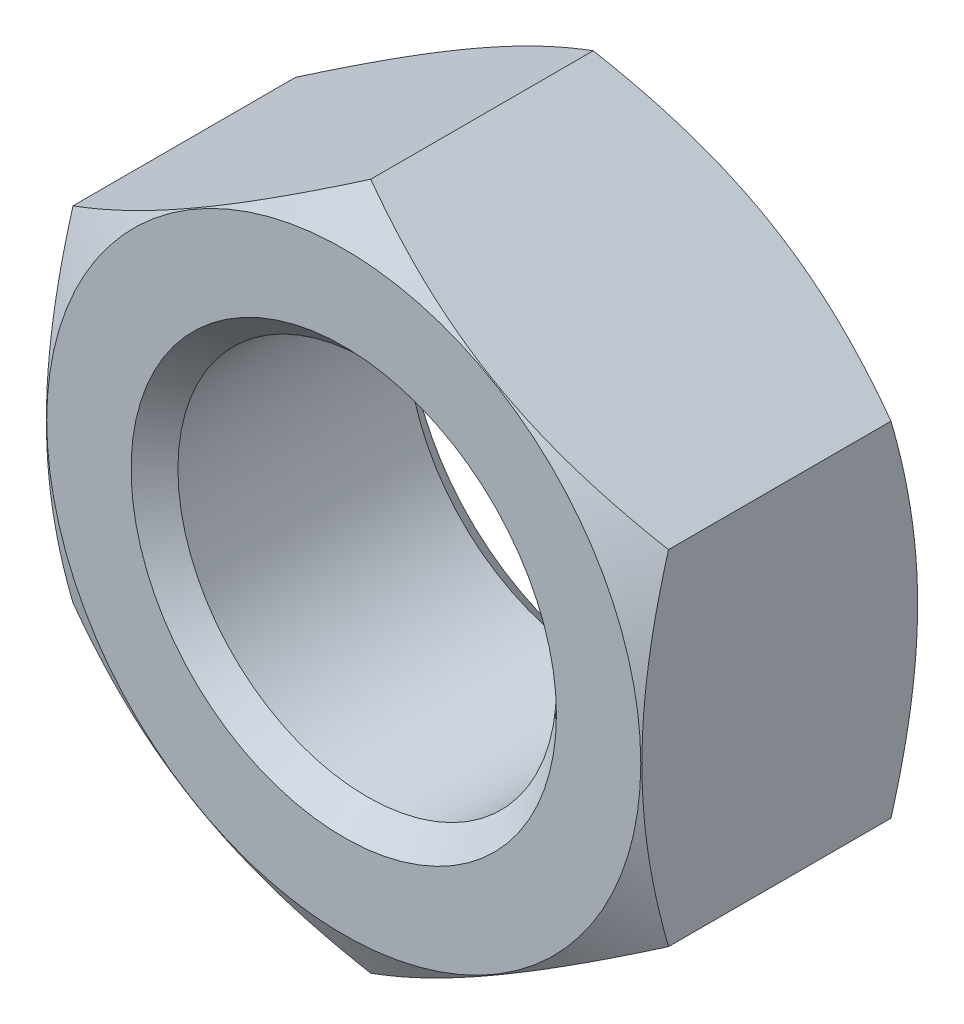
from build123d import *

# Parameters (mm, degrees)
SKETCH_1_R      = 8.8985
EXTRUDE_1_DEPTH = 13
CHAMFER_1_SIZE  = 1.1015


with BuildPart() as part:
    # Эскиз1 → Бобышка-Вытянуть1 (new body)
    with BuildSketch(Plane.XY):
        Polygon((0, 16.165807537), (-14, 8.082903769), (-14, -8.082903769), (0, -16.165807537), (14, -8.082903769), (14, 8.082903769), align=None)
        Circle(SKETCH_1_R, mode=Mode.SUBTRACT)
    extrude(amount=-EXTRUDE_1_DEPTH)

    # Эскиз2 → Вырез-Повернуть1 (revolve, cut)
    with BuildSketch(Plane(origin=(0, 0, 0), x_dir=(0, 0, -1), z_dir=(1, 0, 0)), mode=Mode.PRIVATE) as cut_revolve_1_sk:
        Polygon((0, 13.965807537), (5.773502692, 23.965807537), (0, 23.965807537), align=None)
        Polygon((13, 23.965807537), (13, 13.965807537), (7.226497308, 23.965807537), align=None)
    revolve(cut_revolve_1_sk.sketch.rotate(Axis((0, 0, 0), (0, 0, 1)), 90), axis=Axis((0, 0, 0), (0, 0, 1)), mode=Mode.SUBTRACT)

    # Фаска1
    chamfer_1_edges = [part.edges().sort_by_distance(p)[0] for p in [
        (-8.8985, 0, -13),
        (-8.8985, 0, 0),
    ]]
    chamfer(chamfer_1_edges, length=CHAMFER_1_SIZE)


solid = part.part
